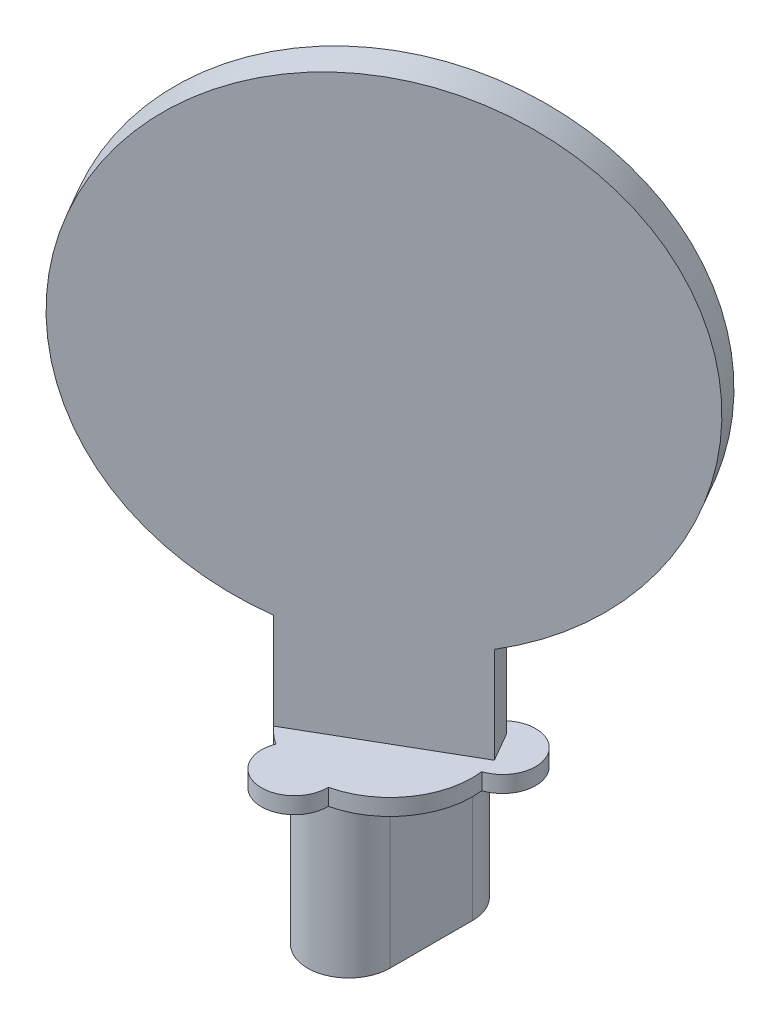
from build123d import *

# Parameters (mm, degrees)
BOSS_EXTRUDE1_DEPTH = 10
BOSS_EXTRUDE2_DEPTH = 1
BOSS_EXTRUDE3_DEPTH = 20
SKETCH2_R           = 15
BOSS_EXTRUDE4_DEPTH = 2


with BuildPart() as part:
    # Sketch1 → Boss-Extrude1 (new body)
    with BuildSketch(Plane(origin=(0, 0, 0), x_dir=(1, 0, 0), z_dir=(0, 1, 0))):
        with BuildLine():
            Line((2.5, 2.5), (2.5, -2.5))
            ThreePointArc((2.5, -2.5), (0, -5), (-2.5, -2.5))
            Line((-2.5, -2.5), (-2.5, 2.5))
            ThreePointArc((-2.5, 2.5), (0, 5), (2.5, 2.5))
        make_face()
    extrude(amount=-BOSS_EXTRUDE1_DEPTH)

    # Sketch1<3> → Boss-Extrude2 (add)
    with BuildSketch(Plane(origin=(0, 0, 0), x_dir=(1, 0, 0), z_dir=(0, 1, 0))):
        with BuildLine():
            ThreePointArc((3.00392096, 3.997056275), (-0.435778714, 4.98097349), (-3.652366189, 3.414706608))
            ThreePointArc((-3.652366189, 3.414706608), (-6.577848346, 2.394141003), (-4.992805922, -0.268121289))
            ThreePointArc((-4.992805922, -0.268121289), (-4.330127019, -2.5), (-2.728602809, -4.18983612))
            ThreePointArc((-2.728602809, -4.18983612), (-1.215537244, -6.893654271), (1.131039574, -4.870395208))
            ThreePointArc((1.131039574, -4.870395208), (4.095760221, -2.867882182), (4.963512755, 0.602943725))
            ThreePointArc((4.963512755, 0.602943725), (6.062177826, 3.5), (3.00392096, 3.997056275))
        make_face()
    extrude(amount=-BOSS_EXTRUDE2_DEPTH)

    # Sketch1<5> → Boss-Extrude3 (add)
    with BuildSketch(Plane(origin=(0, 0, 0), x_dir=(1, 0, 0), z_dir=(0, 1, 0))):
        Polygon((3.742640687, 3.315515147), (4.742640687, 1.583464339), (-3.742640687, -3.315515147), (-4.742640687, -1.583464339), align=None)
    extrude(amount=BOSS_EXTRUDE3_DEPTH)

    # Sketch2 → Boss-Extrude4 (add)
    with BuildSketch(Plane(origin=(-0.500000000000002, 0, -0.8660254037844417), x_dir=(-0.8660254037844386, 0, 0.5000000000000002), z_dir=(-0.5000000000000001, 0, -0.8660254037844385))):
        with Locations((0, 20)):
            Circle(SKETCH2_R)
    extrude(amount=-BOSS_EXTRUDE4_DEPTH)


solid = part.part
